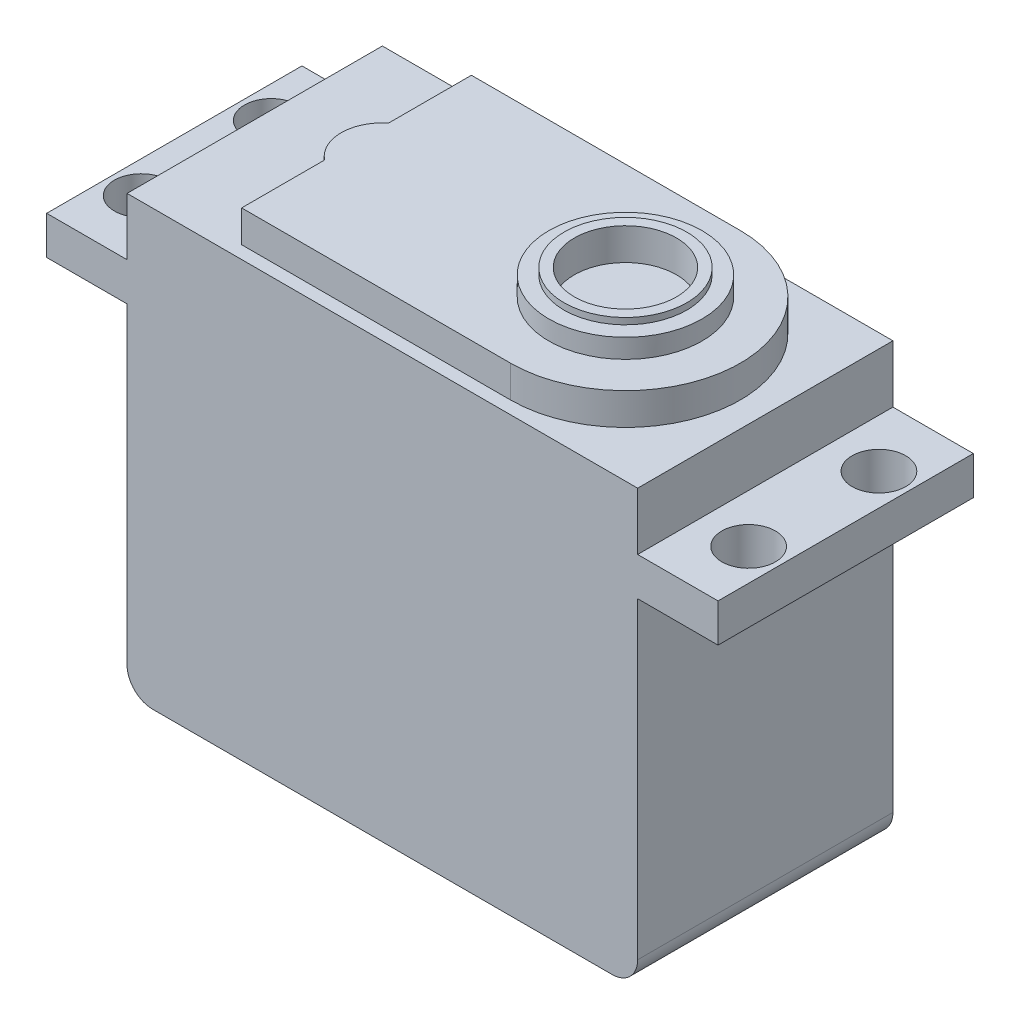
from build123d import *

# Parameters (mm, degrees)
BOSS_EXTRUDE1_DEPTH = 20
SKETCH2_R           = 2.1
CUT_EXTRUDE1_DEPTH  = 20
SKETCH3_R           = 2.098017688
SKETCH3_R_2         = 2.10074066
CUT_EXTRUDE2_DEPTH  = 20
SKETCH7_R           = 6
BOSS_EXTRUDE2_DEPTH = 1.5
SKETCH8_R           = 4.804871241
BOSS_EXTRUDE3_DEPTH = 0.5
SKETCH9_R           = 4.002646766
CUT_EXTRUDE5_DEPTH  = 2.5
SKETCH10_OUTSIDE_W  = 68.236
SKETCH10_OUTSIDE_H  = 35.636
CUT_EXTRUDE6_DEPTH  = 2.5
BOSS_EXTRUDE4_DEPTH = 2.5


with BuildPart() as part:
    # Sketch1 → Boss-Extrude1 (new body)
    with BuildSketch(Plane.XY):
        with BuildLine():
            Line((-2, 0), (-38, 0))
            ThreePointArc((-38, 0), (-39.414213562, 0.585786438), (-40, 2))
            Line((-40, 2), (-40, 26.5))
            Line((-40, 26.5), (-46.3, 26.5))
            Line((-46.3, 26.5), (-46.3, 29.5))
            Line((-46.3, 29.5), (-40, 29.5))
            Line((-40, 29.5), (-40, 34))
            Line((-40, 34), (-33, 34))
            Line((-33, 34), (-33, 36.5))
            Line((-33, 36.5), (0, 36.5))
            Line((0, 36.5), (0, 29.5))
            Line((0, 29.5), (6.3, 29.5))
            Line((6.3, 29.5), (6.3, 26.5))
            Line((6.3, 26.5), (0, 26.5))
            Line((0, 26.5), (0, 2))
            ThreePointArc((0, 2), (-0.585786438, 0.585786438), (-2, 0))
        make_face()
    extrude(amount=BOSS_EXTRUDE1_DEPTH)

    # Sketch2 → Cut-Extrude1 (cut)
    with BuildSketch(Plane(origin=(0, 29.5, 0), x_dir=(1, 0, 0), z_dir=(0, 1, 0))):
        with Locations(Location((3.8, -15.10338686, 0), (0, 0, 270))):
            Circle(SKETCH2_R)
        with Locations(Location((3.8, -4.896599974, 0), (0, 0, 270))):
            Circle(SKETCH2_R)
    extrude(amount=-CUT_EXTRUDE1_DEPTH, mode=Mode.SUBTRACT)

    # Sketch3 → Cut-Extrude2 (cut)
    with BuildSketch(Plane(origin=(0, 29.5, 0), x_dir=(1, 0, 0), z_dir=(0, 1, 0))):
        with Locations(Location((-43.799859357, -15.098694551, 0), (0, 0, 270))):
            Circle(SKETCH3_R)
        with Locations(Location((-43.799859357, -4.903327435, 0), (0, 0, 270))):
            Circle(SKETCH3_R_2)
    extrude(amount=-CUT_EXTRUDE2_DEPTH, mode=Mode.SUBTRACT)

    # Sketch7 → Boss-Extrude2 (add)
    with BuildSketch(Plane(origin=(0, 36.5, 0), x_dir=(1, 0, 0), z_dir=(0, 1, 0))):
        with Locations(Location((-10.95500567, -10, 0), (0, 0, 90))):
            Circle(SKETCH7_R)
    extrude(amount=BOSS_EXTRUDE2_DEPTH)

    # Sketch8 → Boss-Extrude3 (add)
    with BuildSketch(Plane(origin=(0, 38, 0), x_dir=(1, 0, 0), z_dir=(0, 1, 0))):
        with Locations(Location((-10.95500567, -10, 0), (0, 0, 270))):
            Circle(SKETCH8_R)
    extrude(amount=BOSS_EXTRUDE3_DEPTH)

    # Sketch9 → Cut-Extrude5 (cut)
    with BuildSketch(Plane(origin=(0, 38.5, 0), x_dir=(1, 0, 0), z_dir=(0, 1, 0))):
        with Locations(Location((-10.95500567, -10, 0), (0, 0, 270))):
            Circle(SKETCH9_R)
    extrude(amount=-CUT_EXTRUDE5_DEPTH, mode=Mode.SUBTRACT)

    # Sketch10 outside → Cut-Extrude6 (cut)
    with BuildSketch(Plane(origin=(0, 36.5, 0), x_dir=(1, 0, 0), z_dir=(0, 1, 0))):
        with Locations((-20, -10)):
            Rectangle(SKETCH10_OUTSIDE_W, SKETCH10_OUTSIDE_H)
        with BuildLine():
            Line((-32.027169465, -18.996750159), (-10.95500567, -18.996750159))
            ThreePointArc((-10.95500567, -18.996750159), (-1.954759683, -9.996504172), (-10.95500567, -0.996258185))
            Line((-10.95500567, -0.996258185), (-32.027169465, -0.996258185))
            Line((-32.027169465, -0.996258185), (-32.027169465, -18.996750159))
        make_face(mode=Mode.SUBTRACT)
    extrude(amount=-CUT_EXTRUDE6_DEPTH, mode=Mode.SUBTRACT)

    # Sketch11 → Boss-Extrude4 (add)
    with BuildSketch(Plane(origin=(0, 36.5, 0), x_dir=(1, 0, 0), z_dir=(0, 1, 0))):
        with BuildLine():
            Line((-32.027169465, -12.502490339), (-32.027169465, -7.490518005))
            ThreePointArc((-32.027169465, -7.490518005), (-32.914070297, -8.60654479), (-33.230490565, -9.996504172))
            ThreePointArc((-33.230490565, -9.996504172), (-32.914070297, -11.386463554), (-32.027169465, -12.502490339))
        make_face()
    extrude(amount=-BOSS_EXTRUDE4_DEPTH)


solid = part.part
